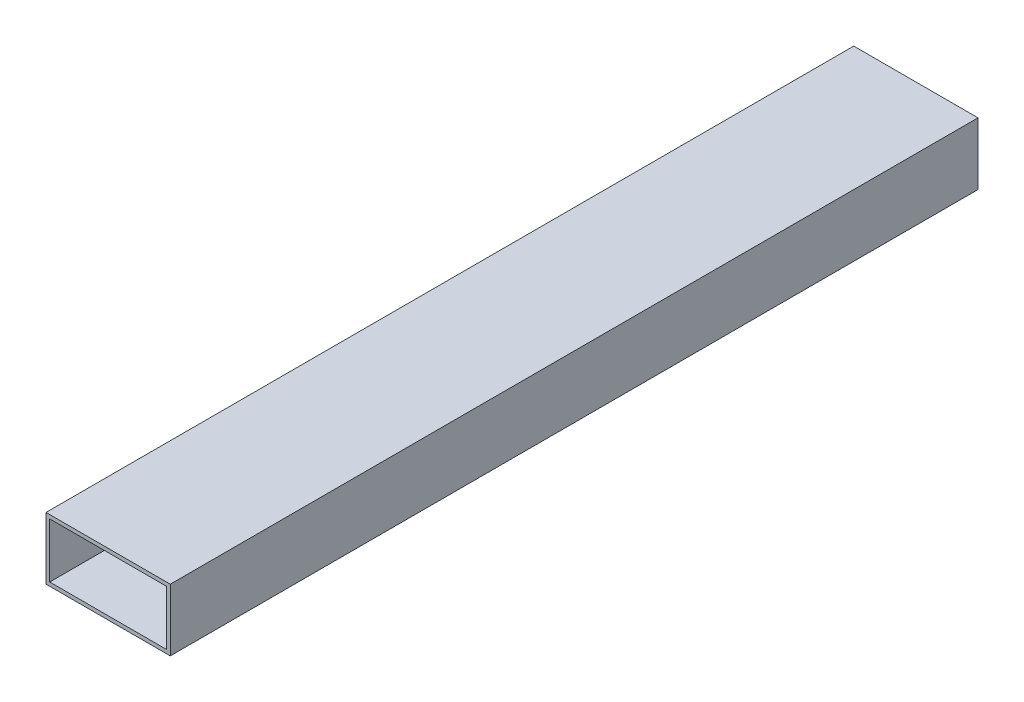
from build123d import *

# Parameters (mm, degrees)
SKETCH1_W           = 50.8
SKETCH1_H           = 25.4
SKETCH1_W_2         = 47.752
SKETCH1_H_2         = 22.352
EXTRUDE_THIN1_DEPTH = 330.2


with BuildPart() as part:
    # Sketch1 → Extrude-Thin1 (new body)
    with BuildSketch(Plane.XY):
        with Locations((-25.4, 12.7)):
            Rectangle(SKETCH1_W, SKETCH1_H)
        with Locations((-25.4, 12.7)):
            Rectangle(SKETCH1_W_2, SKETCH1_H_2, mode=Mode.SUBTRACT)
    extrude(amount=EXTRUDE_THIN1_DEPTH)


solid = part.part
